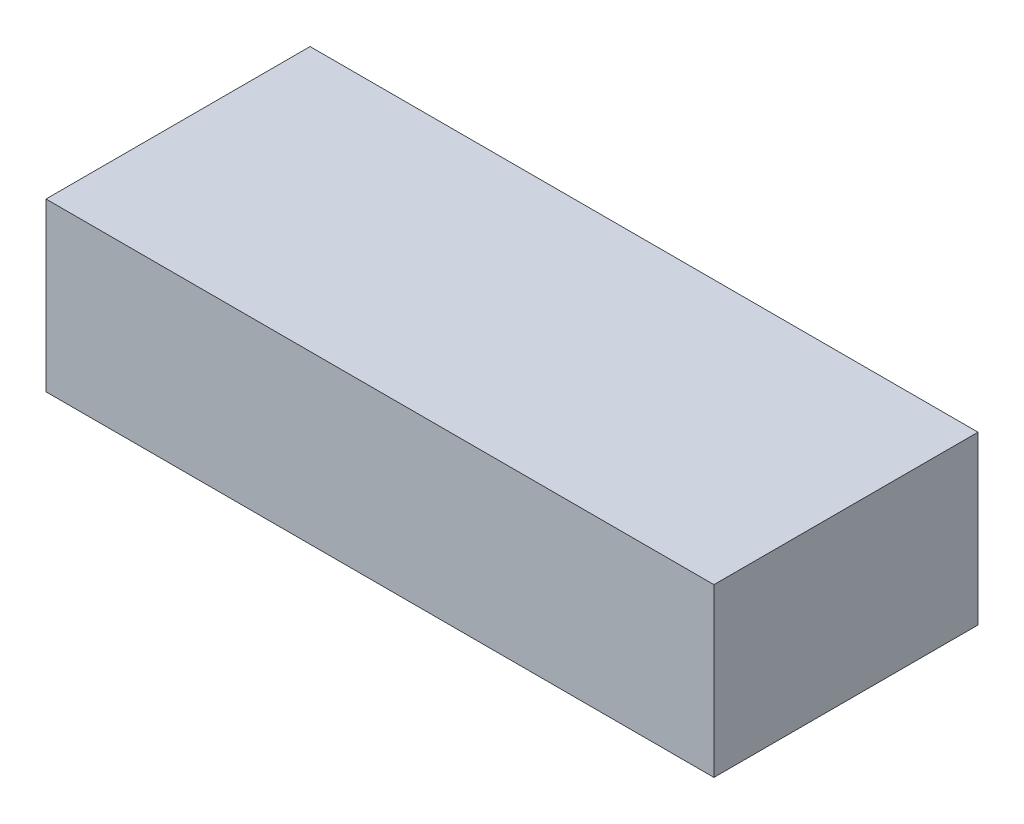
from build123d import *

# Parameters (mm, degrees)
IZIM1_W                     = 172
IZIM1_H                     = 68
Y_KSEKLIK_EKSTR_ZYON1_DEPTH = 21.5


with BuildPart() as part:
    # Çizim1 → Yükseklik-Ekstrüzyon1 (new, symmetric)
    with BuildSketch(Plane(origin=(0, 0, 0), x_dir=(1, 0, 0), z_dir=(0, 1, 0))):
        Rectangle(IZIM1_W, IZIM1_H)
    extrude(amount=Y_KSEKLIK_EKSTR_ZYON1_DEPTH, both=True)


solid = part.part
